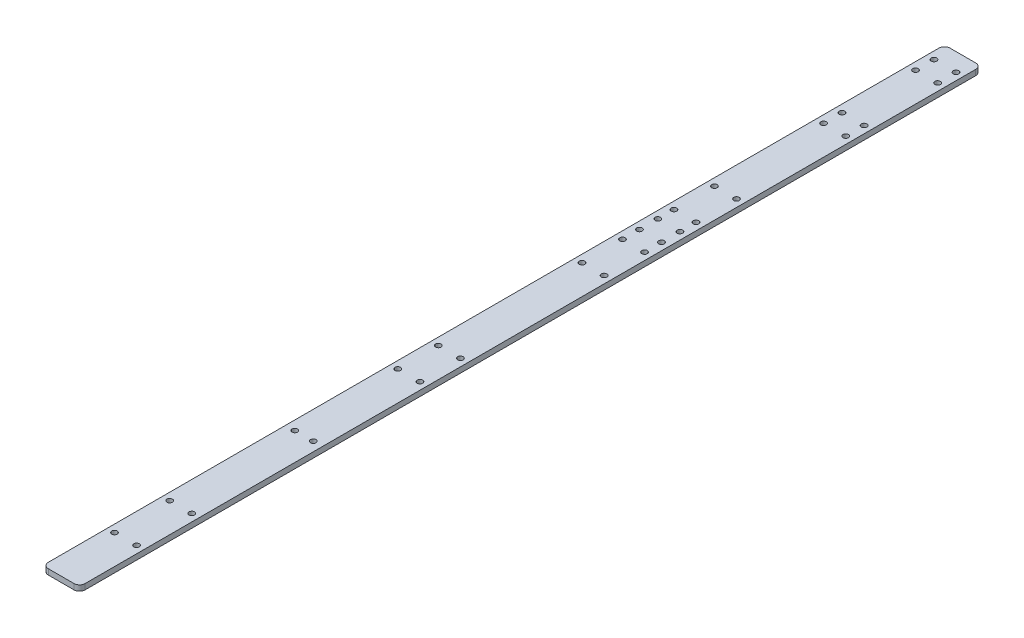
from build123d import *

# Parameters (mm, degrees)
SKETCH_1_W          = 20
SKETCH_1_H          = 510
SKETCH_1_R          = 1.5
EXTRUDE_1_DEPTH     = 3
SKETCH_2_W          = 20
SKETCH_2_H          = 20
CUT_EXTRUDE_1_DEPTH = 257.099704345
FILLET_1_R          = 3
SKETCH_3_R          = 1.5
CUT_EXTRUDE_2_DEPTH = 255.347452337


with BuildPart() as part:
    # 草图1 → 凸台-拉伸1 (new body)
    with BuildSketch(Plane(origin=(0, 0, 0), x_dir=(1, 0, 0), z_dir=(0, 1, 0))):
        with Locations((0.250541192, -0.876894172)):
            Rectangle(SKETCH_1_W, SKETCH_1_H)
        with Locations(Location((5.250541192, -103.876894172, 0), (0, 0, 270))):
            Circle(SKETCH_1_R, mode=Mode.SUBTRACT)
        with Locations(Location((-4.749458808, -103.876894172, 0), (0, 0, 270))):
            Circle(SKETCH_1_R, mode=Mode.SUBTRACT)
        with Locations(Location((6.213384437, -46.87688957, 0), (0, 0, 270))):
            Circle(SKETCH_1_R, mode=Mode.SUBTRACT)
        with Locations(Location((-5.786615563, -46.87688957, 0), (0, 0, 270))):
            Circle(SKETCH_1_R, mode=Mode.SUBTRACT)
        with Locations(Location((6.213384437, -24.87688957, 0), (0, 0, 270))):
            Circle(SKETCH_1_R, mode=Mode.SUBTRACT)
        with Locations(Location((-5.786615563, -24.87688957, 0), (0, 0, 270))):
            Circle(SKETCH_1_R, mode=Mode.SUBTRACT)
        with Locations(Location((6.295138669, 53.123077011, 0), (0, 0, 270))):
            Circle(SKETCH_1_R, mode=Mode.SUBTRACT)
        with Locations(Location((-5.704861331, 53.123077011, 0), (0, 0, 270))):
            Circle(SKETCH_1_R, mode=Mode.SUBTRACT)
        with Locations(Location((6.295138669, 75.123077011, 0), (0, 0, 270))):
            Circle(SKETCH_1_R, mode=Mode.SUBTRACT)
        with Locations(Location((-5.704861331, 75.123077011, 0), (0, 0, 270))):
            Circle(SKETCH_1_R, mode=Mode.SUBTRACT)
        with Locations(Location((6.263384437, 84.37311043, 0), (0, 0, 270))):
            Circle(SKETCH_1_R, mode=Mode.SUBTRACT)
        with Locations(Location((-5.736615563, 84.37311043, 0), (0, 0, 270))):
            Circle(SKETCH_1_R, mode=Mode.SUBTRACT)
        with Locations(Location((6.263384437, 94.37311043, 0), (0, 0, 270))):
            Circle(SKETCH_1_R, mode=Mode.SUBTRACT)
        with Locations(Location((-5.736615563, 94.37311043, 0), (0, 0, 270))):
            Circle(SKETCH_1_R, mode=Mode.SUBTRACT)
        with Locations(Location((6.250541192, 103.123105828, 0), (0, 0, 270))):
            Circle(SKETCH_1_R, mode=Mode.SUBTRACT)
        with Locations(Location((-5.749458808, 103.123105828, 0), (0, 0, 270))):
            Circle(SKETCH_1_R, mode=Mode.SUBTRACT)
        with Locations(Location((6.250541192, 125.123105828, 0), (0, 0, 270))):
            Circle(SKETCH_1_R, mode=Mode.SUBTRACT)
        with Locations(Location((-5.749458808, 125.123105828, 0), (0, 0, 270))):
            Circle(SKETCH_1_R, mode=Mode.SUBTRACT)
        with Locations(Location((6.345138669, 184.373077011, 0), (0, 0, 270))):
            Circle(SKETCH_1_R, mode=Mode.SUBTRACT)
        with Locations(Location((-5.654861331, 184.373077011, 0), (0, 0, 270))):
            Circle(SKETCH_1_R, mode=Mode.SUBTRACT)
        with Locations(Location((6.345138669, 194.373077011, 0), (0, 0, 270))):
            Circle(SKETCH_1_R, mode=Mode.SUBTRACT)
        with Locations(Location((-5.654861331, 194.373077011, 0), (0, 0, 270))):
            Circle(SKETCH_1_R, mode=Mode.SUBTRACT)
        with Locations(Location((6.300541192, 234.373105828, 0), (0, 0, 270))):
            Circle(SKETCH_1_R, mode=Mode.SUBTRACT)
        with Locations(Location((-5.699458808, 234.373105828, 0), (0, 0, 270))):
            Circle(SKETCH_1_R, mode=Mode.SUBTRACT)
        with Locations(Location((6.300541192, 244.373105828, 0), (0, 0, 270))):
            Circle(SKETCH_1_R, mode=Mode.SUBTRACT)
        with Locations(Location((-5.699458808, 244.373105828, 0), (0, 0, 270))):
            Circle(SKETCH_1_R, mode=Mode.SUBTRACT)
    extrude(amount=EXTRUDE_1_DEPTH)

    # 草图2 → 切除-拉伸1 (cut, through all)
    with BuildSketch(Plane(origin=(0, 3, 0), x_dir=(1, 0, 0), z_dir=(0, 1, 0))):
        with Locations((0.250541192, -245.876894172)):
            Rectangle(SKETCH_2_W, SKETCH_2_H)
    extrude(amount=-CUT_EXTRUDE_1_DEPTH, mode=Mode.SUBTRACT)

    # 圆角1
    fillet_1_edges = [part.edges().sort_by_distance(p)[0] for p in [
        (-9.749458808, 1.5, 235.876894172),
        (10.250541192, 1.5, 235.876894172),
        (10.250541192, 1.5, -254.123105828),
        (-9.749458808, 1.5, -254.123105828),
    ]]
    fillet(fillet_1_edges, radius=FILLET_1_R)

    # 草图3 → 切除-拉伸2 (cut, through all)
    with BuildSketch(Plane(origin=(0, 3, 0), x_dir=(1, 0, 0), z_dir=(0, 1, 0))):
        with Locations(Location((-5.749458808, -170.876894172, 0), (0, 0, 270))):
            Circle(SKETCH_3_R)
        with Locations(Location((-5.749458808, -200.876894172, 0), (0, 0, 270))):
            Circle(SKETCH_3_R)
        with Locations(Location((6.250541192, -170.876894172, 0), (0, 0, 90))):
            Circle(SKETCH_3_R)
        with Locations(Location((6.250541192, -200.876894172, 0), (0, 0, 90))):
            Circle(SKETCH_3_R)
    extrude(amount=-CUT_EXTRUDE_2_DEPTH, mode=Mode.SUBTRACT)


solid = part.part
